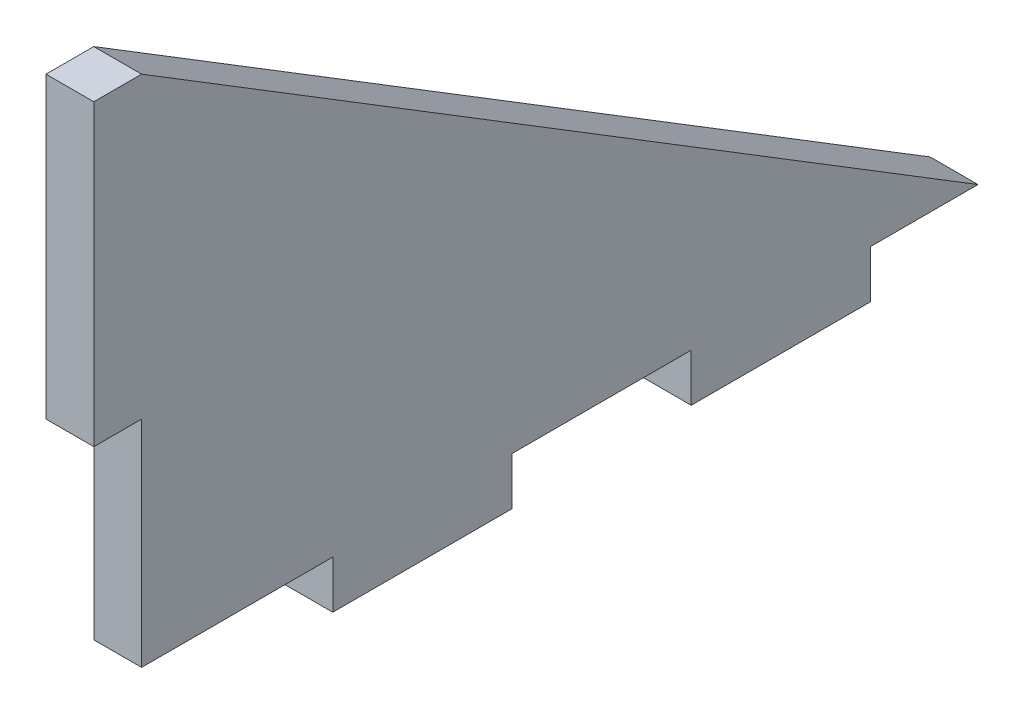
from build123d import *

# Parameters (mm, degrees)
SKETCH1_W           = 15
SKETCH1_H           = 4
SKETCH1_W_2         = 4
SKETCH1_H_2         = 25
BOSS_EXTRUDE1_DEPTH = 4


with BuildPart() as part:
    # Sketch1 → Boss-Extrude1 (new body)
    with BuildSketch(Plane(origin=(0, 0, 0), x_dir=(0, 0, -1), z_dir=(1, 0, 0))):
        Polygon((70, 0), (0, 0), (0, 43), align=None)
        with Locations((53.5, -2)):
            Rectangle(SKETCH1_W, SKETCH1_H)
        with Locations((23.5, -2)):
            Rectangle(SKETCH1_W, SKETCH1_H)
        with Locations((-2, 30.5)):
            Rectangle(SKETCH1_W_2, SKETCH1_H_2)
    extrude(amount=BOSS_EXTRUDE1_DEPTH)


solid = part.part
